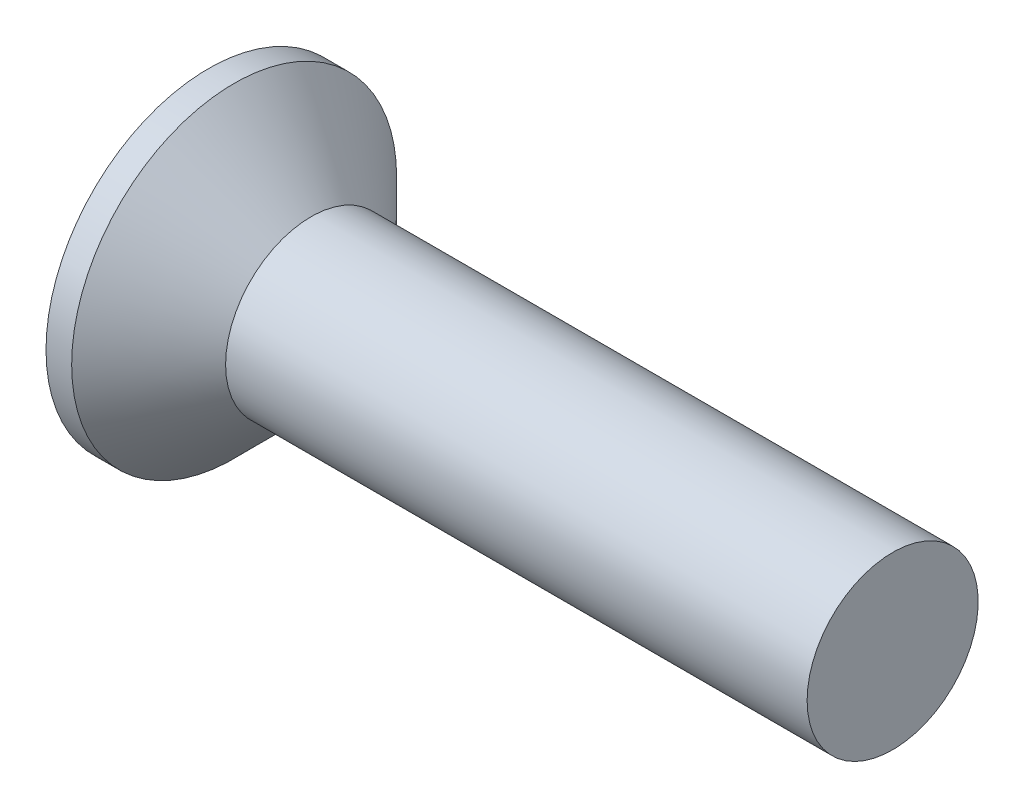
from build123d import *


with BuildPart() as part:
    # BodySke → Base-Revolve (revolve)
    with BuildSketch(Plane.XY, mode=Mode.PRIVATE) as base_revolve_sk:
        Polygon((0, 0), (0, 1.9), (0.3, 1.9), (1.2, 1), (8, 1), (8, 0), align=None)
    revolve(base_revolve_sk.sketch.rotate(Axis((-6.35, 0, 0), (1, 0, 0)), 90), axis=Axis((-6.35, 0, 0), (1, 0, 0)))


solid = part.part
